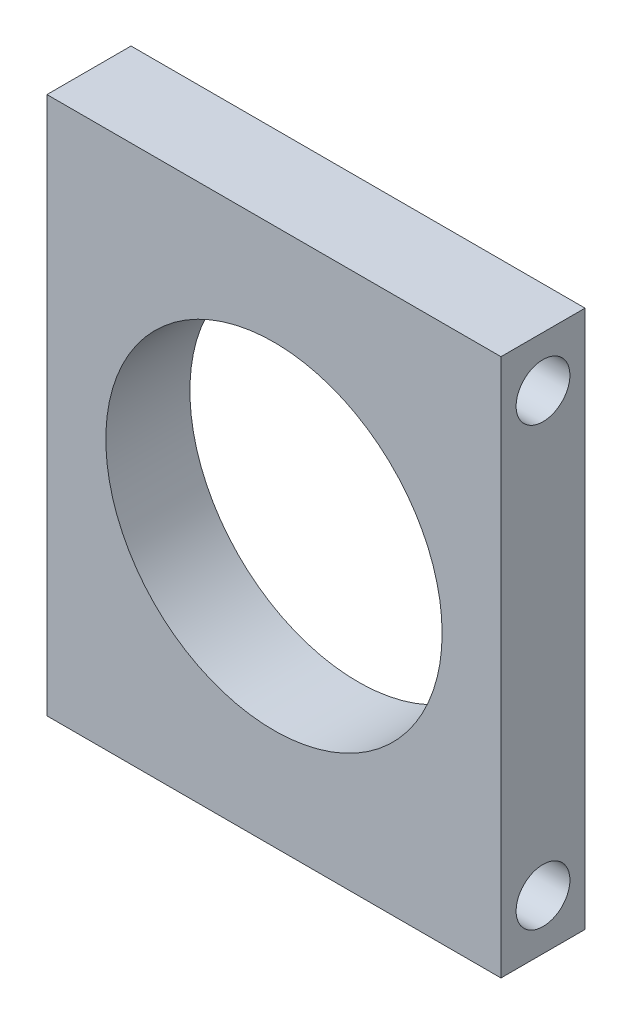
from build123d import *

# Parameters (mm, degrees)
SKETCH_2_W          = 27
SKETCH_2_H          = 32
EXTRUDE_1_DEPTH     = 5
SKETCH_3_R          = 10
CUT_EXTRUDE_1_DEPTH = 64
SKETCH_5_R          = 1.6
CUT_EXTRUDE_2_DEPTH = 64


with BuildPart() as part:
    # 草图2 → 凸台-拉伸1 (new body)
    with BuildSketch(Plane.XY):
        with Locations((13.5, -16)):
            Rectangle(SKETCH_2_W, SKETCH_2_H)
    extrude(amount=EXTRUDE_1_DEPTH)

    # 草图3 → 切除-拉伸1 (cut)
    with BuildSketch(Plane.XY.offset(5)):
        with Locations((13.5, -16)):
            Circle(SKETCH_3_R)
    extrude(amount=-CUT_EXTRUDE_1_DEPTH, mode=Mode.SUBTRACT)

    # 草图5 → 切除-拉伸2 (cut)
    with BuildSketch(Plane.ZY):
        with Locations(Location((2.5, -3, 0), (0, 0, 270))):
            Circle(SKETCH_5_R)
        with Locations(Location((2.5, -29, 0), (0, 0, 270))):
            Circle(SKETCH_5_R)
    extrude(amount=-CUT_EXTRUDE_2_DEPTH, mode=Mode.SUBTRACT)


solid = part.part
